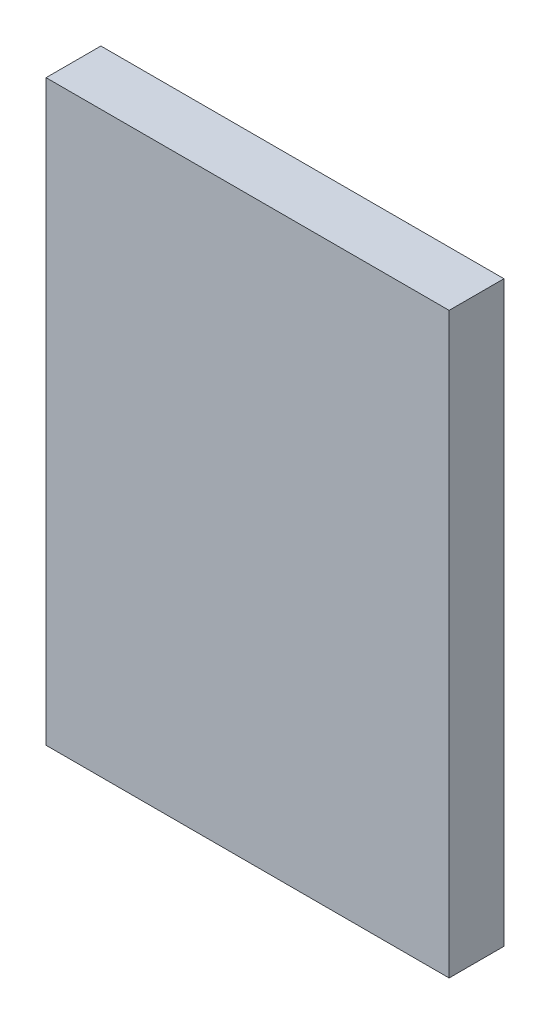
from build123d import *

# Parameters (mm, degrees)
SKETCH_1_W                  = 69.85
SKETCH_1_H                  = 100.2
HDD_69_85X100_2X9_5_1_DEPTH = 9.5


with BuildPart() as part:
    # Эскиз1 → HDD_69_85x100_2x9_5_1 (new body)
    with BuildSketch(Plane.XY):
        with Locations((0, -8.1)):
            Rectangle(SKETCH_1_W, SKETCH_1_H)
    extrude(amount=HDD_69_85X100_2X9_5_1_DEPTH)


solid = part.part
